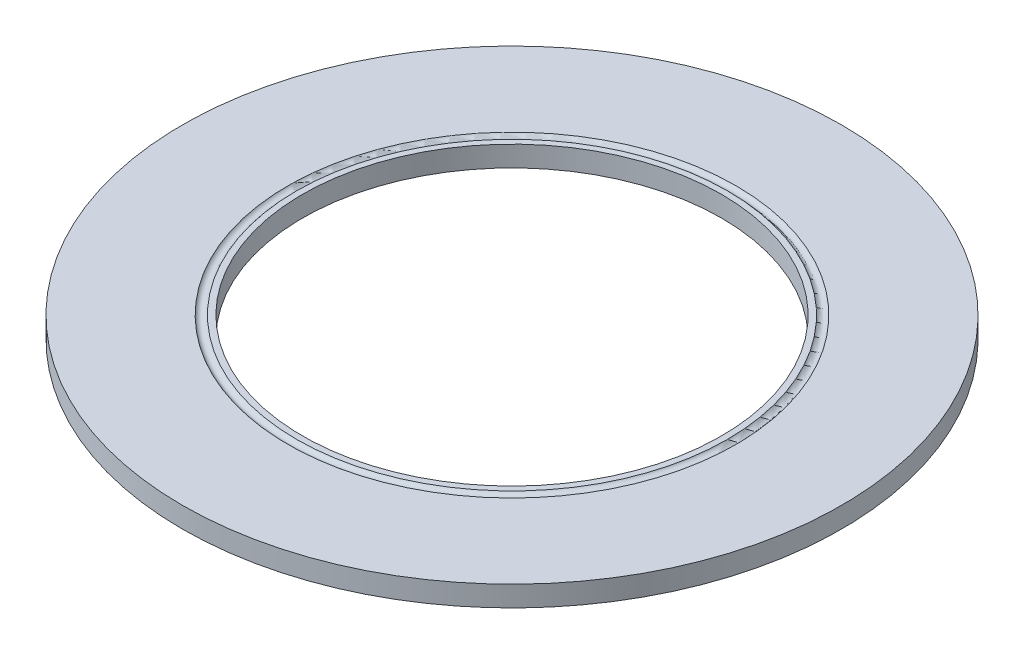
from build123d import *


with BuildPart() as part:
    # Sketch1 → Revolve1 (revolve)
    with BuildSketch(Plane.XY, mode=Mode.PRIVATE) as revolve1_sk:
        with BuildLine():
            Line((-96.8375, 0), (-99.585688315, 0))
            ThreePointArc((-99.585688315, 0), (-101.6, 1.11125), (-103.614311685, 0))
            Line((-103.614311685, 0), (-152.4, 0))
            Line((-152.4, 0), (-152.4, 9.525))
            Line((-152.4, 9.525), (-103.614311685, 9.525))
            ThreePointArc((-103.614311685, 9.525), (-101.6, 8.41375), (-99.585688315, 9.525))
            Line((-99.585688315, 9.525), (-96.8375, 9.525))
            Line((-96.8375, 9.525), (-96.8375, 0))
        make_face()
    revolve(revolve1_sk.sketch.rotate(Axis((0, 0, 0), (0, 1, 0)), 270), axis=Axis((0, 0, 0), (0, 1, 0)))


solid = part.part
